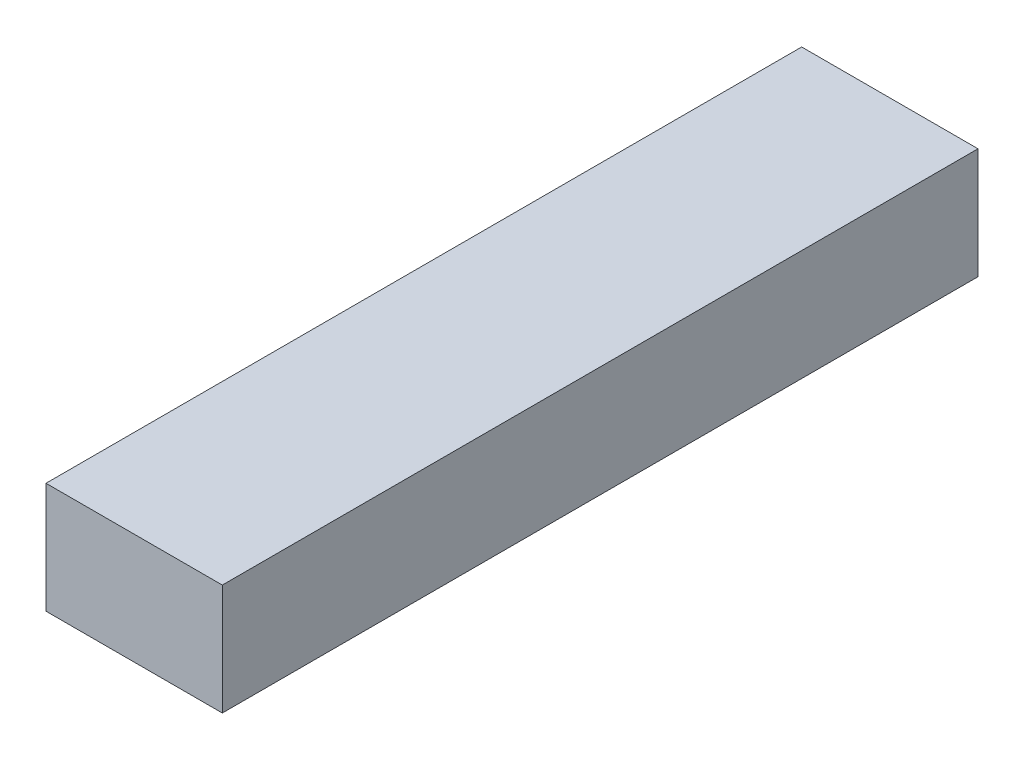
from build123d import *

# Parameters (mm, degrees)
SKETCH1_W           = 70
SKETCH1_H           = 44
BOSS_EXTRUDE1_DEPTH = 300


with BuildPart() as part:
    # Sketch1 → Boss-Extrude1 (new body)
    with BuildSketch(Plane.XY):
        Rectangle(SKETCH1_W, SKETCH1_H)
    extrude(amount=BOSS_EXTRUDE1_DEPTH)


solid = part.part
